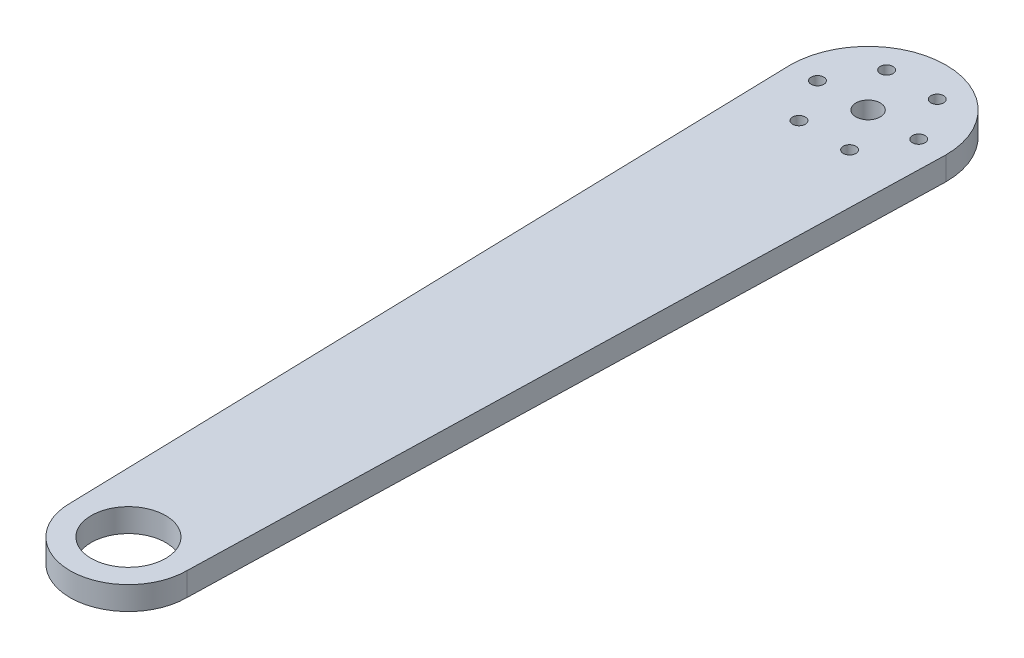
from build123d import *

# Parameters (mm, degrees)
SKETCH1_R           = 3.125
SKETCH1_R_2         = 1.625
SKETCH1_R_3         = 9.55
BOSS_EXTRUDE1_DEPTH = 6


with BuildPart() as part:
    # Sketch1 → Boss-Extrude1 (new body)
    with BuildSketch(Plane(origin=(0, 0, 0), x_dir=(1, 0, 0), z_dir=(0, 1, 0))):
        with BuildLine():
            Line((-15, -190), (-20, 0))
            ThreePointArc((-20, 0), (0, 20), (20, 0))
            Line((20, 0), (15, -190))
            ThreePointArc((15, -190), (0, -205), (-15, -190))
        make_face()
        with Locations(Location((0, 0, 0), (0, 0, 270))):
            Circle(SKETCH1_R, mode=Mode.SUBTRACT)
        with Locations(Location((-13, 0, 0), (0, 0, 270))):
            Circle(SKETCH1_R_2, mode=Mode.SUBTRACT)
        with Locations(Location((-6.5, 11.258330249, 0), (0, 0, 270))):
            Circle(SKETCH1_R_2, mode=Mode.SUBTRACT)
        with Locations(Location((6.5, 11.258330249, 0), (0, 0, 270))):
            Circle(SKETCH1_R_2, mode=Mode.SUBTRACT)
        with Locations(Location((13, 0, 0), (0, 0, 270))):
            Circle(SKETCH1_R_2, mode=Mode.SUBTRACT)
        with Locations(Location((6.5, -11.258330249, 0), (0, 0, 270))):
            Circle(SKETCH1_R_2, mode=Mode.SUBTRACT)
        with Locations(Location((-6.5, -11.258330249, 0), (0, 0, 270))):
            Circle(SKETCH1_R_2, mode=Mode.SUBTRACT)
        with Locations(Location((0, -190, 0), (0, 0, 270))):
            Circle(SKETCH1_R_3, mode=Mode.SUBTRACT)
    extrude(amount=BOSS_EXTRUDE1_DEPTH)


solid = part.part
